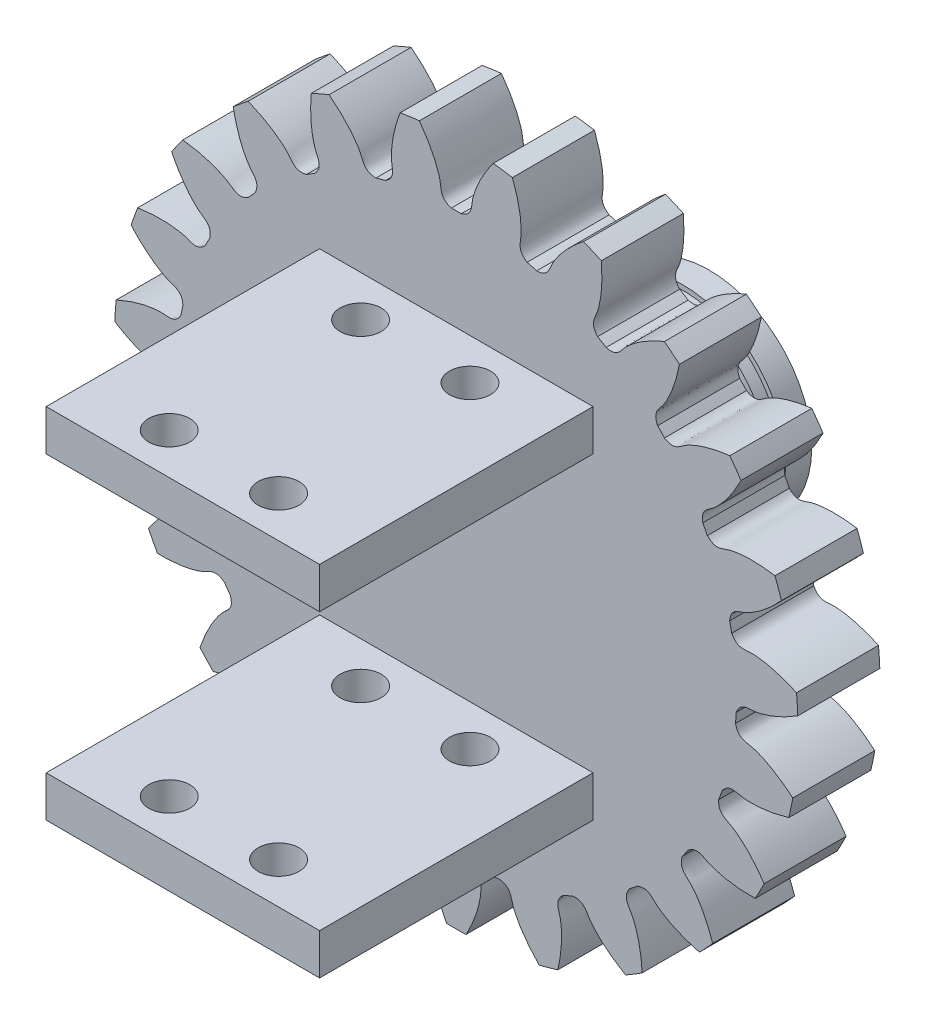
from build123d import *

# Parameters (mm, degrees)
SKETCH_1_R               = 25
EXTRUDE_1_DEPTH          = 6
CUT_EXTRUDE_1_DEPTH      = 36.860842154
PATTERN_CIRCULAR_1_COUNT = 23
SKETCH_4_W               = 20
SKETCH_4_H               = 3
EXTRUDE_2_DEPTH          = 20
SKETCH_5_R               = 1.5
CUT_EXTRUDE_2_DEPTH      = 45
SKETCH_6_R               = 8.5
EXTRUDE_3_DEPTH          = 2.5
SKETCH_7_R               = 7.5
EXTRUDE_4_DEPTH          = 7
SKETCH_8_R               = 7.15
EXTRUDE_5_DEPTH          = 1.1
SKETCH_9_R               = 7.5
EXTRUDE_6_DEPTH          = 1.9
FILLET_1_R               = 1.5


with BuildPart() as part:
    # 草图1 → 凸台-拉伸1 (new body)
    with BuildSketch(Plane.XY):
        Circle(SKETCH_1_R)
    extrude(amount=EXTRUDE_1_DEPTH)

    # 草图2 → 切除-拉伸1 (cut, through all)
    with BuildSketch(Plane.XY):
        with BuildLine():
            ThreePointArc((0.362755305, 20.496790202), (0, 20.5), (-0.362755305, 20.496790202))
            add(Edge.make_bspline(
                [(-0.362755305, 20.496790202), (-1.155466972, 20.733525948), (-1.087520616, 21.26767434), (-1.185859869, 21.794351938), (-1.198995845, 21.857849297), (-1.215324159, 21.929500041), (-1.235163177, 22.009201186), (-1.258844493, 22.096836763), (-1.286691262, 22.192281901), (-1.319024726, 22.295401644), (-1.356161833, 22.406051438), (-1.398415633, 22.524077112), (-1.446094819, 22.649315017), (-1.499503533, 22.781592128), (-1.5589411, 22.920726165), (-1.624701785, 23.066525721), (-1.697074541, 23.218790386), (-1.776342776, 23.377310889), (-1.862784108, 23.541869241), (-1.956670134, 23.71223888), (-2.058266195, 23.888184833), (-2.167831155, 24.069463867), (-2.28561717, 24.255824664), (-2.411869476, 24.447007991), (-2.546826167, 24.642746874), (-2.690717991, 24.842766783), (-2.843768139, 25.046785824), (-3.006192046, 25.254514926), (-3.178197192, 25.465658044), (-3.359982914, 25.679912362), (-3.551740212, 25.8969685), (-3.753651576, 26.116510729), (-3.965890802, 26.338217186), (-4.188622824, 26.561760101), (-4.422003548, 26.786806019), (-4.666179691, 27.013016034), (-4.921288623, 27.240046023), (-5.18745824, 27.467546885), (-5.464806735, 27.695164787), (-5.854182413, 28.001900287), (-6.156580907, 28.225592313), (-6.363361531, 28.372391104)],
                knots=[0, 0, 0, 0, 0.147386897, 0.152959532, 0.159389495, 0.166676786, 0.174821406, 0.183823355, 0.193682632, 0.204399237, 0.21597317, 0.228404432, 0.241693023, 0.255838942, 0.270842189, 0.286702764, 0.303420668, 0.320995901, 0.339428462, 0.358718351, 0.378865568, 0.399870114, 0.421731989, 0.444451192, 0.468027723, 0.492461582, 0.517752771, 0.543901287, 0.570907132, 0.598770305, 0.627490807, 0.657068637, 0.687503795, 0.718796282, 0.750946098, 0.783953241, 0.817817713, 0.852539514, 0.888118643, 0.9245551, 1, 1, 1, 1], degree=3))
            ThreePointArc((-6.363361531, 28.372391104), (0, 29.077223852), (6.363361531, 28.372391104))
            add(Edge.make_bspline(
                [(0.362755305, 20.496790202), (1.155466972, 20.733525948), (1.087520616, 21.26767434), (1.185859869, 21.794351938), (1.198995845, 21.857849297), (1.215324159, 21.929500041), (1.235163177, 22.009201186), (1.258844493, 22.096836763), (1.286691262, 22.192281901), (1.319024726, 22.295401644), (1.356161833, 22.406051438), (1.398415633, 22.524077112), (1.446094819, 22.649315017), (1.499503533, 22.781592128), (1.5589411, 22.920726165), (1.624701785, 23.066525721), (1.697074541, 23.218790386), (1.776342776, 23.377310889), (1.862784108, 23.541869241), (1.956670134, 23.71223888), (2.058266195, 23.888184833), (2.167831155, 24.069463867), (2.28561717, 24.255824664), (2.411869476, 24.447007991), (2.546826167, 24.642746874), (2.690717991, 24.842766783), (2.843768139, 25.046785824), (3.006192046, 25.254514926), (3.178197192, 25.465658044), (3.359982914, 25.679912362), (3.551740212, 25.8969685), (3.753651576, 26.116510729), (3.965890802, 26.338217186), (4.188622824, 26.561760101), (4.422003548, 26.786806019), (4.666179691, 27.013016034), (4.921288623, 27.240046023), (5.18745824, 27.467546885), (5.464806735, 27.695164787), (5.854182413, 28.001900287), (6.156580907, 28.225592313), (6.363361531, 28.372391104)],
                knots=[0, 0, 0, 0, 0.147386897, 0.152959532, 0.159389495, 0.166676786, 0.174821406, 0.183823355, 0.193682632, 0.204399237, 0.21597317, 0.228404432, 0.241693023, 0.255838942, 0.270842189, 0.286702764, 0.303420668, 0.320995901, 0.339428462, 0.358718351, 0.378865568, 0.399870114, 0.421731989, 0.444451192, 0.468027723, 0.492461582, 0.517752771, 0.543901287, 0.570907132, 0.598770305, 0.627490807, 0.657068637, 0.687503795, 0.718796282, 0.750946098, 0.783953241, 0.817817713, 0.852539514, 0.888118643, 0.9245551, 1, 1, 1, 1], degree=3))
        make_face()
    cut_extrude_1 = extrude(amount=CUT_EXTRUDE_1_DEPTH, mode=Mode.SUBTRACT)

    # 阵列(圆周)1: 切除-拉伸1 ×23 about axis
    pattern_circular_1_axis = Axis((0, 0, 6), (0, 0, -1))
    for i in range(1, PATTERN_CIRCULAR_1_COUNT):
        add(cut_extrude_1.rotate(pattern_circular_1_axis, i * 360 / PATTERN_CIRCULAR_1_COUNT), mode=Mode.SUBTRACT)

    # 草图4 → 凸台-拉伸2 (add)
    with BuildSketch(Plane.XY.offset(6)):
        with Locations((0, 11.6)):
            Rectangle(SKETCH_4_W, SKETCH_4_H)
        with Locations((0, -11.6)):
            Rectangle(SKETCH_4_W, SKETCH_4_H)
    extrude(amount=EXTRUDE_2_DEPTH)

    # 草图5 → 切除-拉伸2 (cut)
    with BuildSketch(Plane.XZ.offset(13.1)):
        with Locations((-4, 23)):
            Circle(SKETCH_5_R)
        with Locations((4, 23)):
            Circle(SKETCH_5_R)
        with Locations((-4, 9)):
            Circle(SKETCH_5_R)
        with Locations((4, 9)):
            Circle(SKETCH_5_R)
    extrude(amount=-CUT_EXTRUDE_2_DEPTH, mode=Mode.SUBTRACT)

    # 草图6 → 凸台-拉伸3 (add)
    with BuildSketch(Plane(origin=(0, 0, 0), x_dir=(-1, 0, 0), z_dir=(0, 0, -1))):
        Circle(SKETCH_6_R)
    extrude(amount=EXTRUDE_3_DEPTH)

    # 草图7 → 凸台-拉伸4 (add)
    with BuildSketch(Plane(origin=(0, 0, -2.5), x_dir=(-1, 0, 0), z_dir=(0, 0, -1))):
        Circle(SKETCH_7_R)
    extrude(amount=EXTRUDE_4_DEPTH)

    # 草图8 → 凸台-拉伸5 (add)
    with BuildSketch(Plane(origin=(0, 0, -9.5), x_dir=(-1, 0, 0), z_dir=(0, 0, -1))):
        Circle(SKETCH_8_R)
    extrude(amount=EXTRUDE_5_DEPTH)

    # 草图9 → 凸台-拉伸6 (add)
    with BuildSketch(Plane(origin=(0, 0, -10.6), x_dir=(-1, 0, 0), z_dir=(0, 0, -1))):
        Circle(SKETCH_9_R)
    extrude(amount=EXTRUDE_6_DEPTH)

    # 圆角1
    fillet_1_edges = [part.edges().sort_by_distance(p)[0] for p in [
        (8.5, 0, 0),
    ]]
    fillet(fillet_1_edges, radius=FILLET_1_R)


solid = part.part
